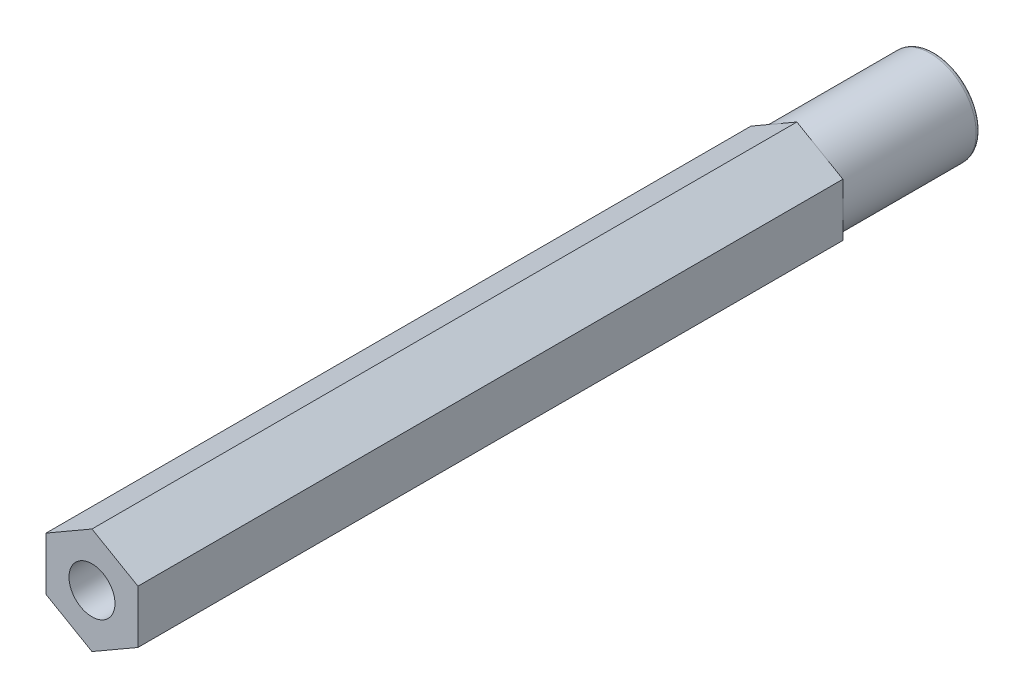
from build123d import *

# Parameters (mm, degrees)
BOSS_EXTRUDE1_DEPTH = 15.333333333
SKETCH2_R           = 0.5
CUT_EXTRUDE1_DEPTH  = 2
SKETCH3_R           = 1
BOSS_EXTRUDE2_DEPTH = 3
FILLET1_R           = 0.1


with BuildPart() as part:
    # Sketch1 → Boss-Extrude1 (new body)
    with BuildSketch(Plane.XY):
        Polygon((0, 1.154700538), (-1, 0.577350269), (-1, -0.577350269), (0, -1.154700538), (1, -0.577350269), (1, 0.577350269), align=None)
    extrude(amount=BOSS_EXTRUDE1_DEPTH)

    # Sketch2 → Cut-Extrude1 (cut)
    with BuildSketch(Plane.XY.offset(15.333333333)):
        Circle(SKETCH2_R)
    extrude(amount=-CUT_EXTRUDE1_DEPTH, mode=Mode.SUBTRACT)

    # Sketch3 → Boss-Extrude2 (add)
    with BuildSketch(Plane(origin=(0, 0, 0), x_dir=(-1, 0, 0), z_dir=(0, 0, -1))):
        Circle(SKETCH3_R)
    extrude(amount=BOSS_EXTRUDE2_DEPTH)

    # Fillet1
    fillet1_edges = [part.edges().sort_by_distance(p)[0] for p in [
        (1, 0, -3),
    ]]
    fillet(fillet1_edges, radius=FILLET1_R)


solid = part.part
